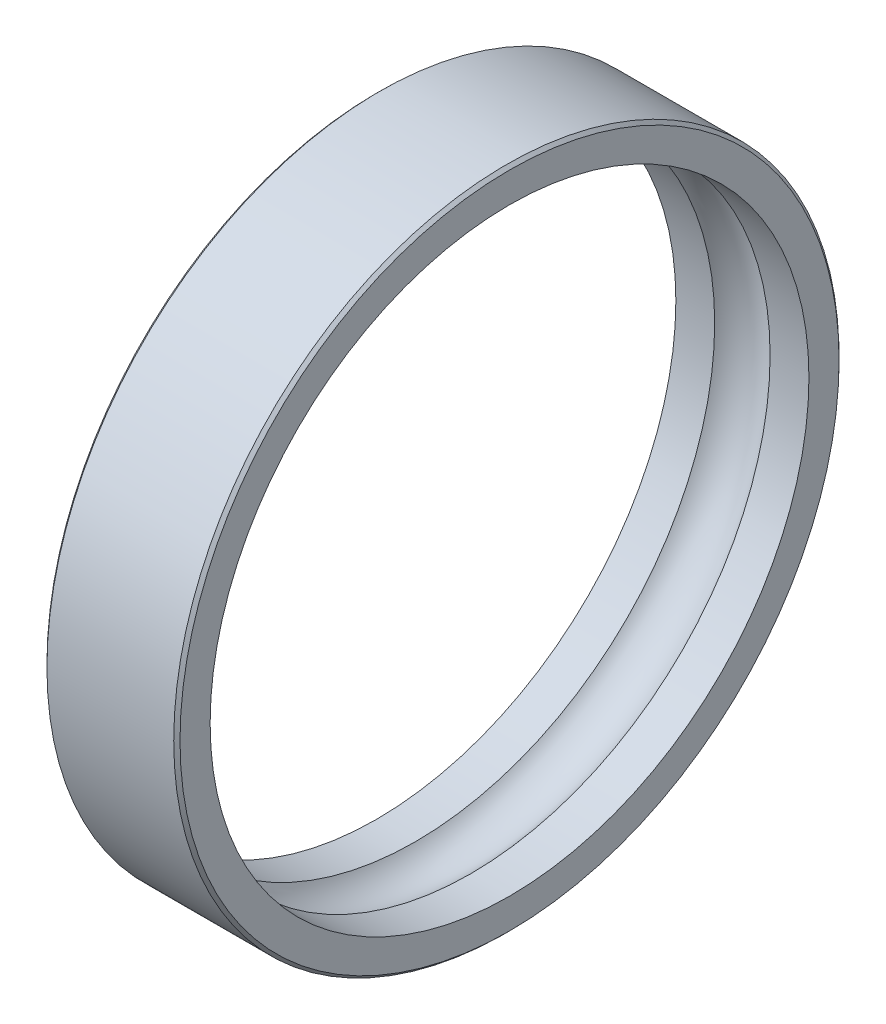
from build123d import *


with BuildPart() as part:
    # Szkic1 → Obrót1 (revolve)
    with BuildSketch(Plane.XY, mode=Mode.PRIVATE) as obr_t1_sk:
        with BuildLine():
            Line((-1.5, 6.75), (-0.6244998, 6.75))
            ThreePointArc((-0.6244998, 6.75), (0, 7.05), (0.6244998, 6.75))
            Line((0.6244998, 6.75), (1.5, 6.75))
            Line((1.5, 6.75), (1.5, 7.429289322))
            Line((1.5, 7.429289322), (1.429289322, 7.5))
            Line((1.429289322, 7.5), (-1.429289322, 7.5))
            Line((-1.429289322, 7.5), (-1.5, 7.429289322))
            Line((-1.5, 7.429289322), (-1.5, 6.75))
        make_face()
    revolve(obr_t1_sk.sketch.rotate(Axis((-10.261969357, 0, 0), (1, 0, 0)), 90), axis=Axis((-10.261969357, 0, 0), (1, 0, 0)))


solid = part.part
